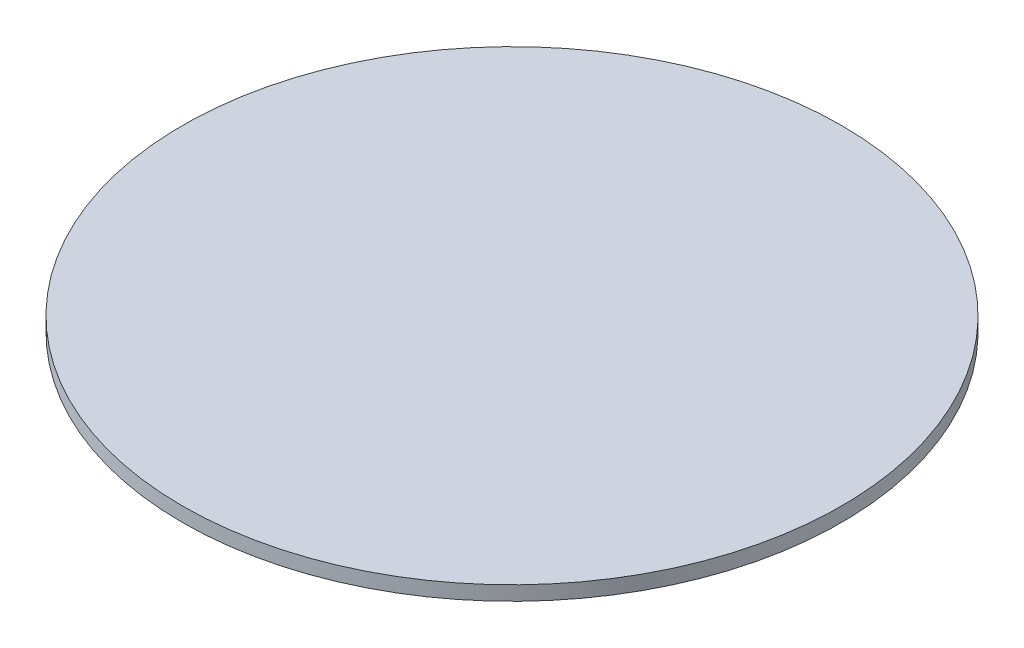
from build123d import *

# Parameters (mm, degrees)
SKETCH1_R           = 11.5
BOSS_EXTRUDE1_DEPTH = 0.5


with BuildPart() as part:
    # Sketch1 → Boss-Extrude1 (new body)
    with BuildSketch(Plane(origin=(0, 0, 0), x_dir=(1, 0, 0), z_dir=(0, 1, 0))):
        with Locations(Location((0, 0, 0), (0, 0, 270))):
            Circle(SKETCH1_R)
    extrude(amount=BOSS_EXTRUDE1_DEPTH)


solid = part.part
